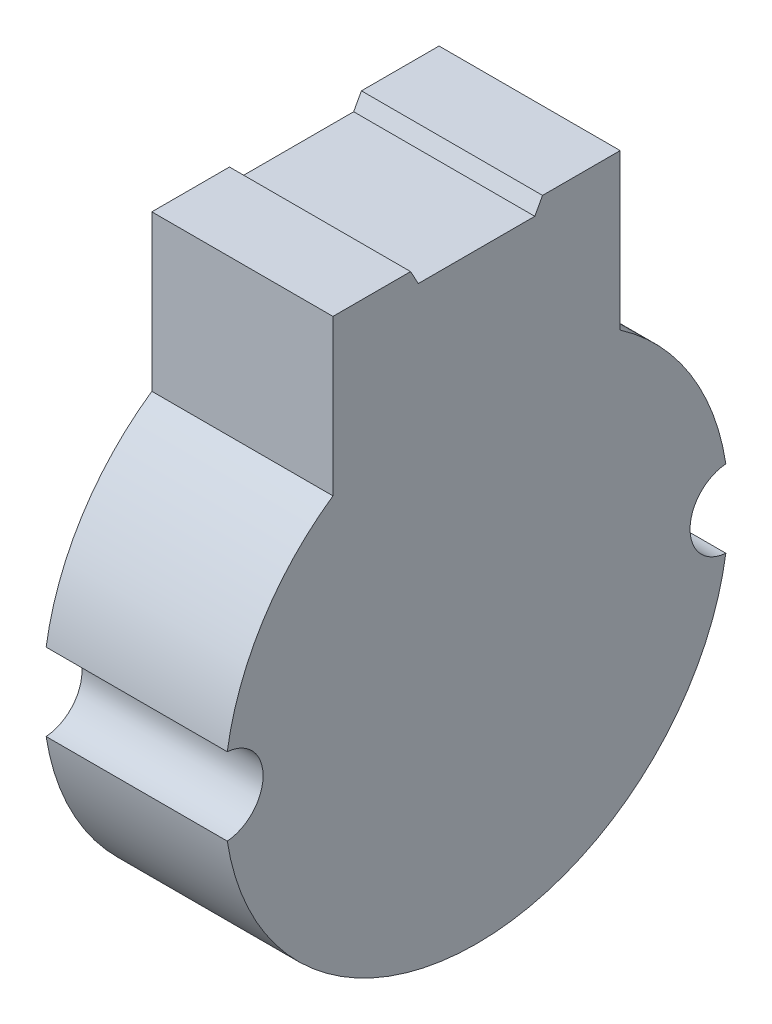
from build123d import *

# Parameters (mm, degrees)
BOSS_EXTRUDE1_DEPTH = 14


with BuildPart() as part:
    # Sketch1 → Boss-Extrude1 (new body)
    with BuildSketch(Plane(origin=(0, 0, 0), x_dir=(0, 0, -1), z_dir=(1, 0, 0))):
        with BuildLine():
            Line((-4.5, 22.673860989), (4.5, 22.673860989))
            Line((4.5, 22.673860989), (5.1, 23.773860989))
            Line((5.1, 23.773860989), (11.1, 23.773860989))
            Line((11.1, 23.773860989), (11.1, 11.75860607))
            ThreePointArc((11.1, 11.75860607), (16.525488971, 6.077864194), (19.269230769, -1.282749897))
            ThreePointArc((19.269230769, -1.282749897), (16.5, -4.273860989), (19.269230769, -7.26497208))
            ThreePointArc((19.269230769, -7.26497208), (0, -23.773860989), (-19.269230769, -7.26497208))
            ThreePointArc((-19.269230769, -7.26497208), (-16.5, -4.273860989), (-19.269230769, -1.282749897))
            ThreePointArc((-19.269230769, -1.282749897), (-16.525488971, 6.077864194), (-11.1, 11.75860607))
            Line((-11.1, 11.75860607), (-11.1, 23.773860989))
            Line((-11.1, 23.773860989), (-5.1, 23.773860989))
            Line((-5.1, 23.773860989), (-4.5, 22.673860989))
        make_face()
    extrude(amount=BOSS_EXTRUDE1_DEPTH)


solid = part.part
